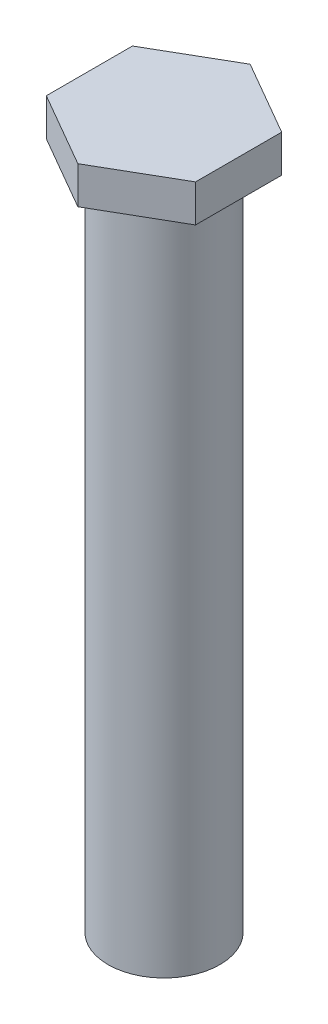
from build123d import *

# Parameters (mm, degrees)
SKETCH1_R           = 9.525
BOSS_EXTRUDE1_DEPTH = 114.3
BOSS_EXTRUDE2_DEPTH = 6.35


with BuildPart() as part:
    # Sketch1 → Boss-Extrude1 (new body)
    with BuildSketch(Plane(origin=(0, 0, 0), x_dir=(1, 0, 0), z_dir=(0, 1, 0))):
        with Locations(Location((0, 0, 0), (0, 0, 270))):
            Circle(SKETCH1_R)
    extrude(amount=BOSS_EXTRUDE1_DEPTH)

    # Sketch2 → Boss-Extrude2 (add)
    with BuildSketch(Plane(origin=(0, 114.3, 0), x_dir=(1, 0, 0), z_dir=(0, 1, 0))):
        Polygon((12.7, 7.332348419), (0, 14.664696837), (-12.7, 7.332348419), (-12.7, -7.332348419), (0, -14.664696837), (12.7, -7.332348419), align=None)
    extrude(amount=BOSS_EXTRUDE2_DEPTH)


solid = part.part
